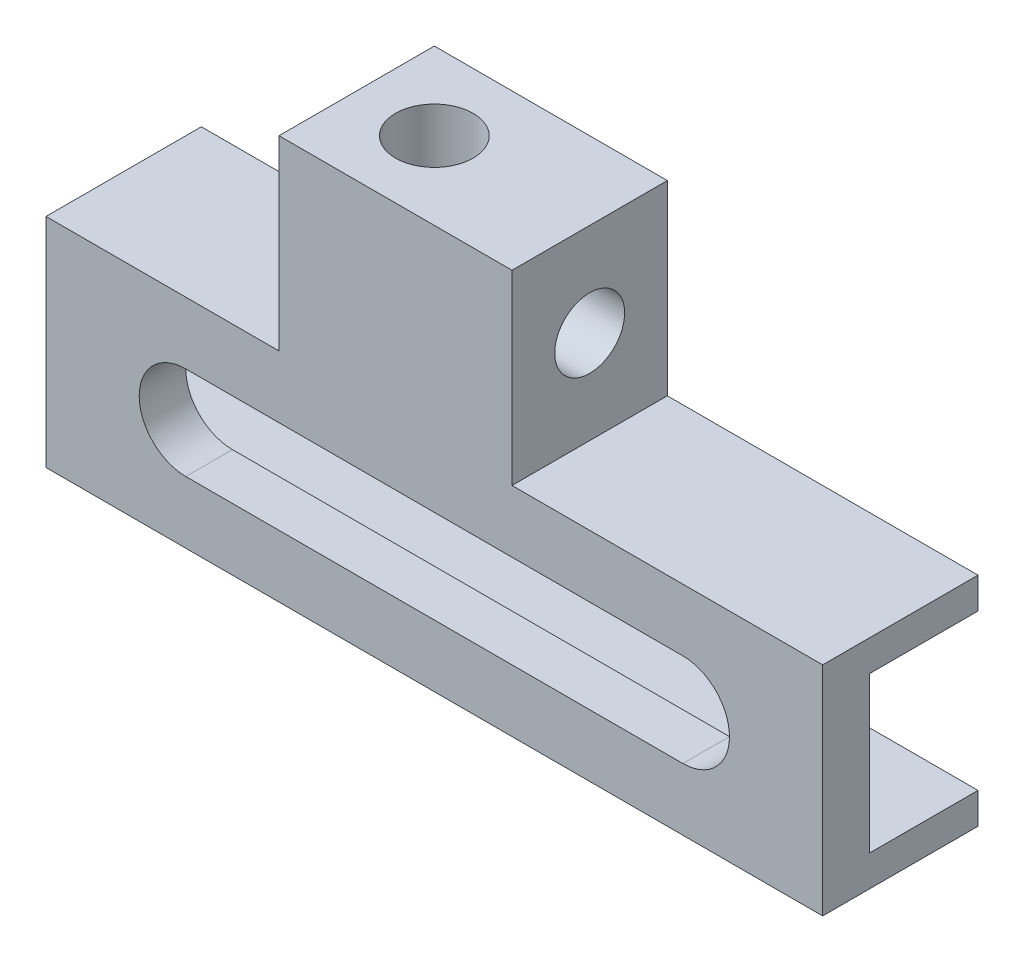
from build123d import *

# Parameters (mm, degrees)
BOSS_EXTRUDE1_DEPTH     = 50
CUT_EXTRUDE1_DEPTH      = 51.970579749
SKETCH4_W               = 15
SKETCH4_H               = 10
BOSS_EXTRUDE2_DEPTH     = 12
SKETCH5_R               = 2.5
CUT_EXTRUDE2_DEPTH      = 10
CUT_EXTRUDE3_REACH      = 38.892
CUT_EXTRUDE3_END_RADIUS = 2.5
SKETCH6_R               = 2.25


with BuildPart() as part:
    # Sketch2 → Boss-Extrude1 (new body)
    with BuildSketch(Plane(origin=(0, 0, 0), x_dir=(0, 0, -1), z_dir=(1, 0, 0))):
        Polygon((0, -7), (0, 7), (10, 7), (10, 5), (3, 5), (3, -5), (10, -5), (10, -7), align=None)
    extrude(amount=BOSS_EXTRUDE1_DEPTH)

    # Sketch3 → Cut-Extrude1 (cut, through all)
    with BuildSketch(Plane(origin=(0, 0, -3), x_dir=(-1, 0, 0), z_dir=(0, 0, -1))):
        with BuildLine():
            Line((-41, 3), (-9, 3))
            ThreePointArc((-9, 3), (-6, 0), (-9, -3))
            Line((-9, -3), (-41, -3))
            ThreePointArc((-41, -3), (-44, 0), (-41, 3))
        make_face()
    extrude(amount=-CUT_EXTRUDE1_DEPTH, mode=Mode.SUBTRACT)

    # Sketch4 → Boss-Extrude2 (add)
    with BuildSketch(Plane(origin=(0, 7, 0), x_dir=(1, 0, 0), z_dir=(0, 1, 0))):
        with Locations((22.5, 5)):
            Rectangle(SKETCH4_W, SKETCH4_H)
    extrude(amount=BOSS_EXTRUDE2_DEPTH)

    # Sketch5 → Cut-Extrude2 (cut)
    with BuildSketch(Plane(origin=(0, 19, 0), x_dir=(1, 0, 0), z_dir=(0, 1, 0))):
        with Locations(Location((20, 5, 0), (0, 0, 270))):
            Circle(SKETCH5_R)
    extrude(amount=-CUT_EXTRUDE2_DEPTH, mode=Mode.SUBTRACT)

    # Cut-Extrude3: up to this cylinder (the profile starts outside it)
    cut_extrude3_end = Plane(origin=(20, 13, -5), z_dir=(0, 1, 0)) * Cylinder(CUT_EXTRUDE3_END_RADIUS, 83.784, mode=Mode.PRIVATE)
    # Sketch6 → Cut-Extrude3 (cut, up to the surface)
    with BuildSketch(Plane(origin=(30, 0, 0), x_dir=(0, 0, -1), z_dir=(1, 0, 0)), mode=Mode.PRIVATE) as cut_extrude3_sk1:
        with Locations((5, 13)):
            Circle(SKETCH6_R)
    cut_extrude3_tool1 = extrude(cut_extrude3_sk1.sketch, amount=-CUT_EXTRUDE3_REACH, mode=Mode.PRIVATE) - cut_extrude3_end
    add(cut_extrude3_tool1.solids().sort_by_distance((30, 13, -5))[0], mode=Mode.SUBTRACT)


solid = part.part
